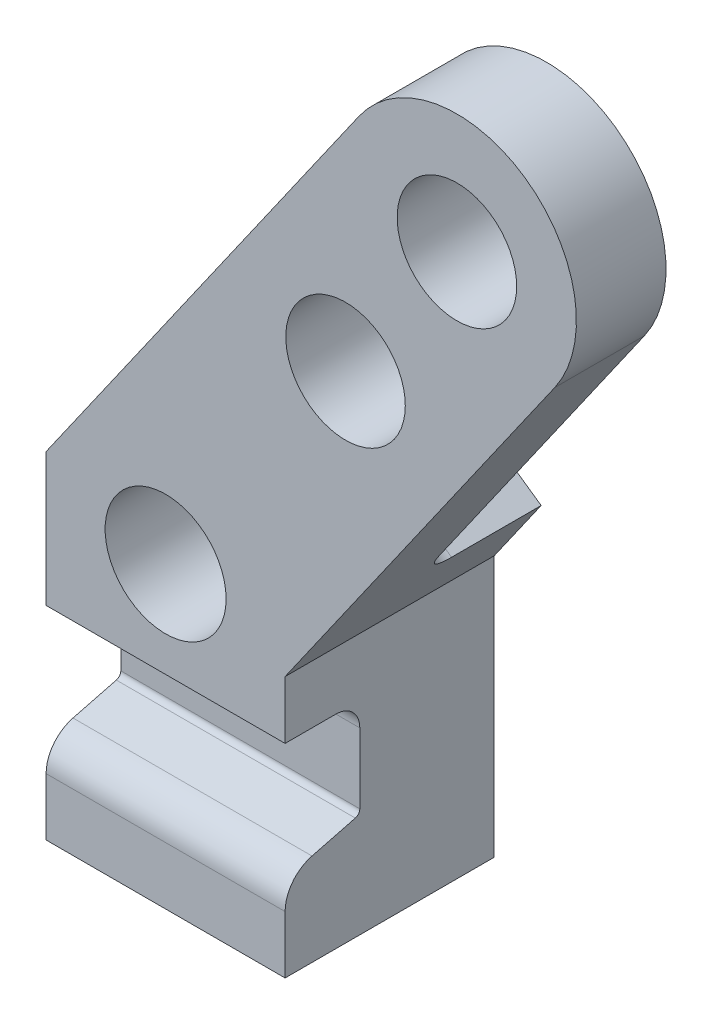
from build123d import *

# Parameters (mm, degrees)
SKETCH_1_R          = 20.25
SKETCH_1_R_2        = 20
EXTRUDE_1_DEPTH     = 70
CUT_EXTRUDE_1_DEPTH = 40
CUT_EXTRUDE_2_DEPTH = 262.804787716
FILLET_1_R          = 12
FILLET_2_R          = 2
FILLET_3_R          = 8
FILLET_4_R          = 10


with BuildPart() as part:
    # 草图1 → 凸台-拉伸1 (new body)
    with BuildSketch(Plane.XY):
        with BuildLine():
            Line((64.741912408, 162.198904983), (-40, 12.611951555))
            Line((-40, 12.611951555), (-40, -100))
            Line((-40, -100), (40, -100))
            Line((40, -100), (40, -12.611951555))
            Line((40, -12.611951555), (130.274075951, 116.312790075))
            ThreePointArc((130.274075951, 116.312790075), (120.451051634, 172.021929301), (64.741912408, 162.198904983))
        make_face()
        Circle(SKETCH_1_R, mode=Mode.SUBTRACT)
        with Locations((97.50799418, 139.255847529)):
            Circle(SKETCH_1_R_2, mode=Mode.SUBTRACT)
        with Locations((60.225525817, 86.01096465)):
            Circle(SKETCH_1_R_2, mode=Mode.SUBTRACT)
    extrude(amount=EXTRUDE_1_DEPTH)

    # 草图2 → 切除-拉伸1 (cut)
    with BuildSketch(Plane.XY):
        Polygon((-9.823024318, 55.709139226), (55.709139226, 9.823024318), (170.424426496, 173.653433175), (104.892262953, 219.539548083), align=None)
    extrude(amount=CUT_EXTRUDE_1_DEPTH, mode=Mode.SUBTRACT)

    # 草图3 → 切除-拉伸2 (cut, through all)
    with BuildSketch(Plane.ZY.offset(40)):
        Polygon((70, -32), (45, -32), (45, -65), (70, -71.454972244), align=None)
    extrude(amount=-CUT_EXTRUDE_2_DEPTH, mode=Mode.SUBTRACT)

    # 圆角1
    fillet_1_edges = [part.edges().sort_by_distance(p)[0] for p in [
        (0, -71.454972244, 70),
    ]]
    fillet(fillet_1_edges, radius=FILLET_1_R)

    # 圆角2
    fillet_2_edges = [part.edges().sort_by_distance(p)[0] for p in [
        (0, -65, 45),
    ]]
    fillet(fillet_2_edges, radius=FILLET_2_R)

    # 圆角3
    fillet_3_edges = [part.edges().sort_by_distance(p)[0] for p in [
        (0, -32, 45),
    ]]
    fillet(fillet_3_edges, radius=FILLET_3_R)

    # 圆角4
    fillet_4_edges = [part.edges().sort_by_distance(p)[0] for p in [
        (22.943057454, 32.766081772, 40),
    ]]
    fillet(fillet_4_edges, radius=FILLET_4_R)


solid = part.part
